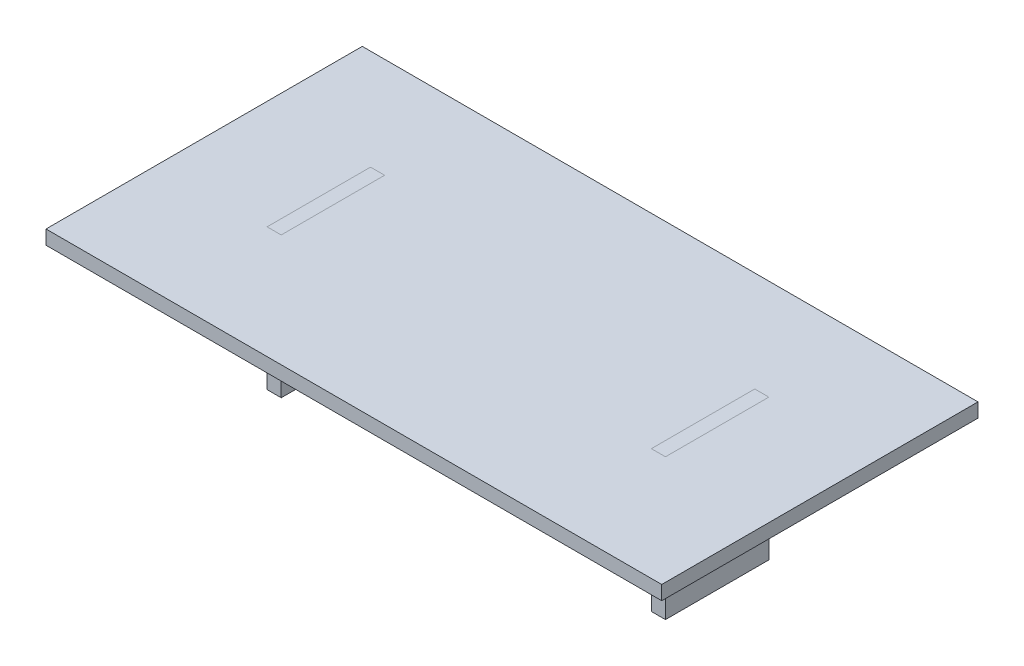
from build123d import *

# Parameters (mm, degrees)
SKETCH1_W             = 3
SKETCH1_H             = 22
BOSS_EXTRUDE1_DEPTH   = 3
SKETCH1_3_W           = 3
SKETCH1_3_H           = 22
BOSS_EXTRUDE2_DEPTH   = 30
BOSS_EXTRUDE2_2_DEPTH = 30
SKETCH2_R             = 3
SKETCH2_R_2           = 1.1
CUT_EXTRUDE1_DEPTH    = 3
SKETCH3_R             = 1.5
CUT_EXTRUDE2_DEPTH    = 3
CIRPATTERN1_COUNT     = 4


with BuildPart() as part:
    # Sketch1 → Boss-Extrude1 (new body)
    with BuildSketch(Plane(origin=(0, 0, 0), x_dir=(1, 0, 0), z_dir=(0, 1, 0))):
        Polygon((-65.748381877, 32.370550162), (-65.748381877, 19.870550162), (-65.748381877, -22.417679095), (-65.748381877, -34.917679095), (65.251618123, -34.917679095), (65.251618123, -22.417679095), (65.251618123, 17.582320905), (65.251618123, 32.370550162), align=None)
        with Locations((-41.123381877, 0)):
            Rectangle(SKETCH1_W, SKETCH1_H, mode=Mode.SUBTRACT)
        with Locations((40.626618123, 0)):
            Rectangle(SKETCH1_W, SKETCH1_H, mode=Mode.SUBTRACT)
    extrude(amount=-BOSS_EXTRUDE1_DEPTH)


with BuildPart() as body_2:
    # Sketch1<3> → Boss-Extrude2 (new body)
    with BuildSketch(Plane(origin=(0, 0, 0), x_dir=(1, 0, 0), z_dir=(0, 1, 0))):
        with Locations((-41.123381877, 0)):
            Rectangle(SKETCH1_3_W, SKETCH1_3_H)
    extrude(amount=-BOSS_EXTRUDE2_DEPTH)

    # Sketch2 → Cut-Extrude1 (cut)
    with BuildSketch(Plane.ZY.offset(42.623381877)):
        with Locations((0, -19)):
            Circle(SKETCH2_R)
        with Locations((-5.656854249, -24.656854249)):
            Circle(SKETCH2_R_2)
    cut_extrude1 = extrude(amount=-CUT_EXTRUDE1_DEPTH, mode=Mode.SUBTRACT)

    # CirPattern1: Cut-Extrude1 ×4 about axis
    cirpattern1_axis = Axis((0, -19, 0), (1, 0, 0))
    for i in range(1, CIRPATTERN1_COUNT):
        add(cut_extrude1.rotate(cirpattern1_axis, i * 360 / CIRPATTERN1_COUNT), mode=Mode.SUBTRACT)


with BuildPart() as body_3:
    # Sketch1<3> → Boss-Extrude2 2 (new body)
    with BuildSketch(Plane(origin=(0, 0, 0), x_dir=(1, 0, 0), z_dir=(0, 1, 0))):
        with Locations((40.626618123, 0)):
            Rectangle(SKETCH1_3_W, SKETCH1_3_H)
    extrude(amount=-BOSS_EXTRUDE2_2_DEPTH)

    # Sketch3 → Cut-Extrude2 (cut)
    with BuildSketch(Plane(origin=(42.126618123, 0, 0), x_dir=(0, 0, -1), z_dir=(1, 0, 0))):
        with Locations((0, -19)):
            Circle(SKETCH3_R)
    extrude(amount=-CUT_EXTRUDE2_DEPTH, mode=Mode.SUBTRACT)


solid = Compound([part.part, body_2.part, body_3.part])
